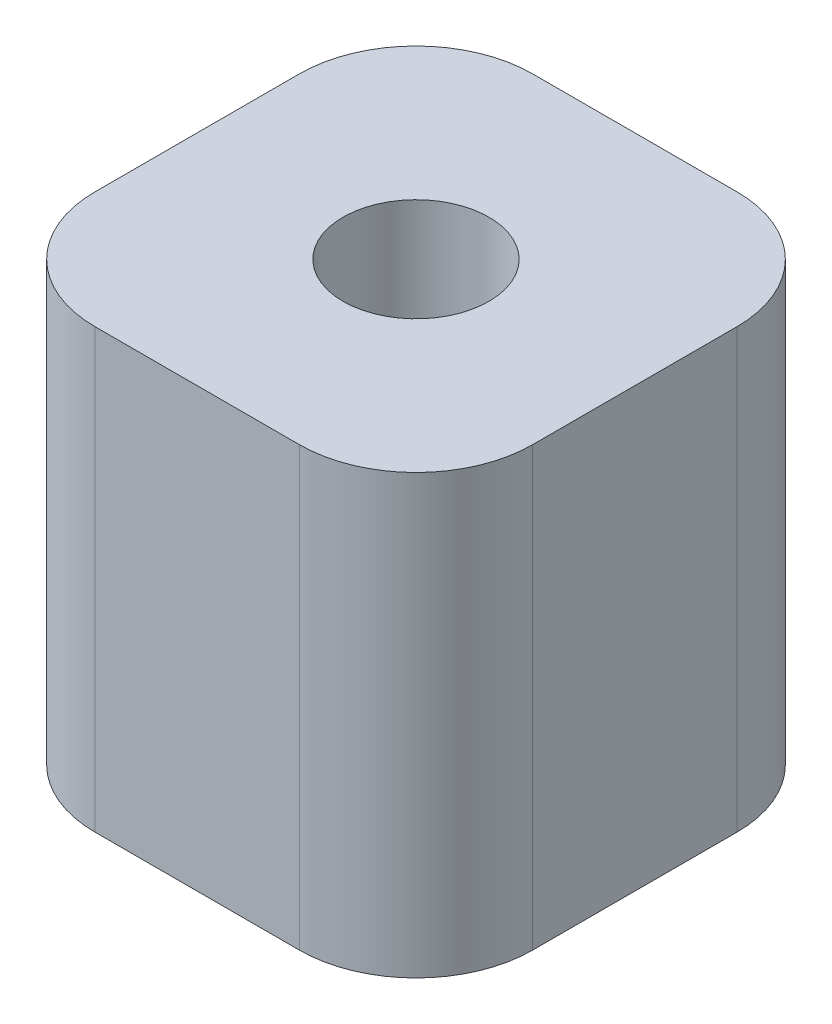
from build123d import *

# Parameters (mm, degrees)
BOSS_EXTRUDE1_DEPTH = 7.5
SKETCH2_R           = 1.25
CUT_EXTRUDE1_DEPTH  = 2.5


with BuildPart() as part:
    # Sketch1 → Boss-Extrude1 (new body)
    with BuildSketch(Plane(origin=(0, 0, 0), x_dir=(1, 0, 0), z_dir=(0, 1, 0))):
        with BuildLine():
            Line((-1.75, 3.75), (1.75, 3.75))
            ThreePointArc((1.75, 3.75), (3.164213562, 3.164213562), (3.75, 1.75))
            Line((3.75, 1.75), (3.75, -1.75))
            ThreePointArc((3.75, -1.75), (3.164213562, -3.164213562), (1.75, -3.75))
            Line((1.75, -3.75), (-1.75, -3.75))
            ThreePointArc((-1.75, -3.75), (-3.164213562, -3.164213562), (-3.75, -1.75))
            Line((-3.75, -1.75), (-3.75, 1.75))
            ThreePointArc((-3.75, 1.75), (-3.164213562, 3.164213562), (-1.75, 3.75))
        make_face()
    extrude(amount=BOSS_EXTRUDE1_DEPTH)

    # Sketch2 → Cut-Extrude1 (cut)
    with BuildSketch(Plane(origin=(0, 7.5, 0), x_dir=(1, 0, 0), z_dir=(0, 1, 0))):
        with Locations(Location((0, 0, 0), (0, 0, 270))):
            Circle(SKETCH2_R)
    extrude(amount=-CUT_EXTRUDE1_DEPTH, mode=Mode.SUBTRACT)


solid = part.part
